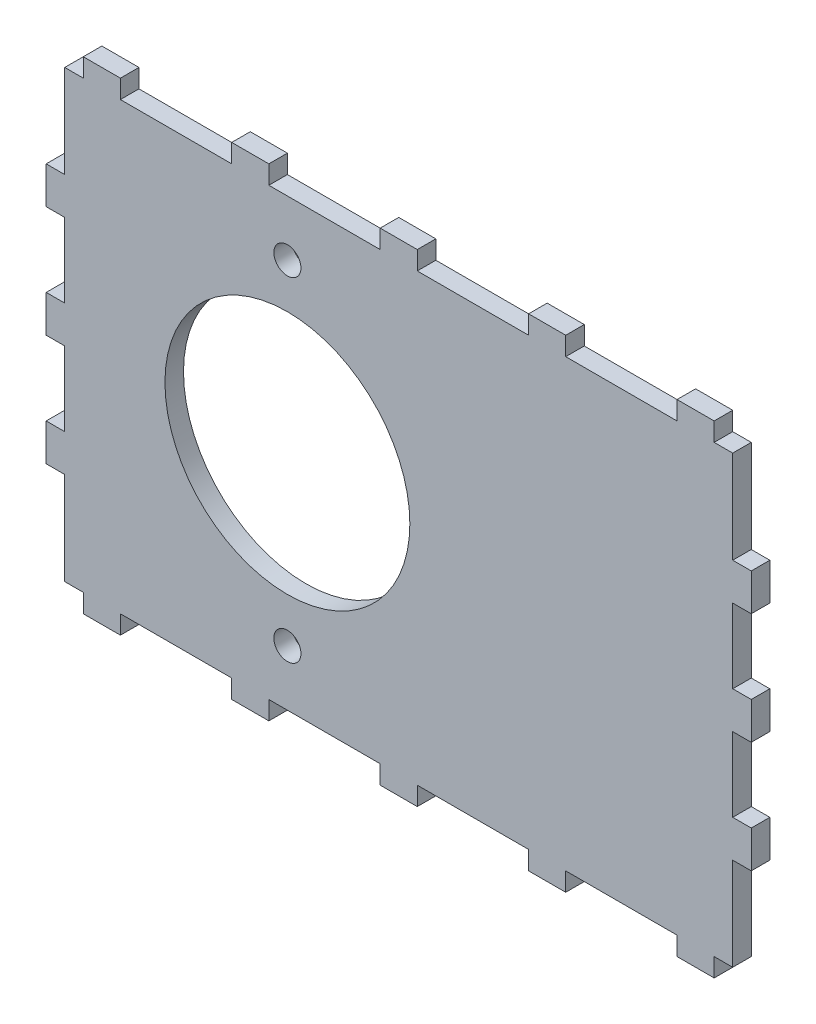
from build123d import *

# Parameters (mm, degrees)
SKETCH1_R           = 33
SKETCH1_R_2         = 3.65
BOSS_EXTRUDE1_DEPTH = 5


with BuildPart() as part:
    # Sketch1 → Boss-Extrude1 (new body)
    with BuildSketch(Plane.XY):
        Polygon((-85, 60), (-85, 65), (-75, 65), (-75, 60), (-45, 60), (-45, 65), (-35, 65), (-35, 60), (-5, 60), (-5, 65), (5, 65), (5, 60), (35, 60), (35, 65), (45, 65), (45, 60), (75, 60), (75, 65), (85, 65), (85, 60), (90, 60), (90, 35), (95, 35), (95, 25), (90, 25), (90, 5), (95, 5), (95, -5), (90, -5), (90, -25), (95, -25), (95, -35), (90, -35), (90, -60), (85, -60), (85, -65), (75, -65), (75, -60), (45, -60), (45, -65), (35, -65), (35, -60), (5, -60), (5, -65), (-5, -65), (-5, -60), (-35, -60), (-35, -65), (-45, -65), (-45, -60), (-75, -60), (-75, -65), (-85, -65), (-85, -60), (-90, -60), (-90, -35), (-95, -35), (-95, -25), (-90, -25), (-90, -5), (-95, -5), (-95, 5), (-90, 5), (-90, 25), (-95, 25), (-95, 35), (-90, 35), (-90, 60), align=None)
        with Locations((-30, 0)):
            Circle(SKETCH1_R, mode=Mode.SUBTRACT)
        with Locations((-30, -45)):
            Circle(SKETCH1_R_2, mode=Mode.SUBTRACT)
        with Locations((-30, 45)):
            Circle(SKETCH1_R_2, mode=Mode.SUBTRACT)
    extrude(amount=BOSS_EXTRUDE1_DEPTH)


solid = part.part
